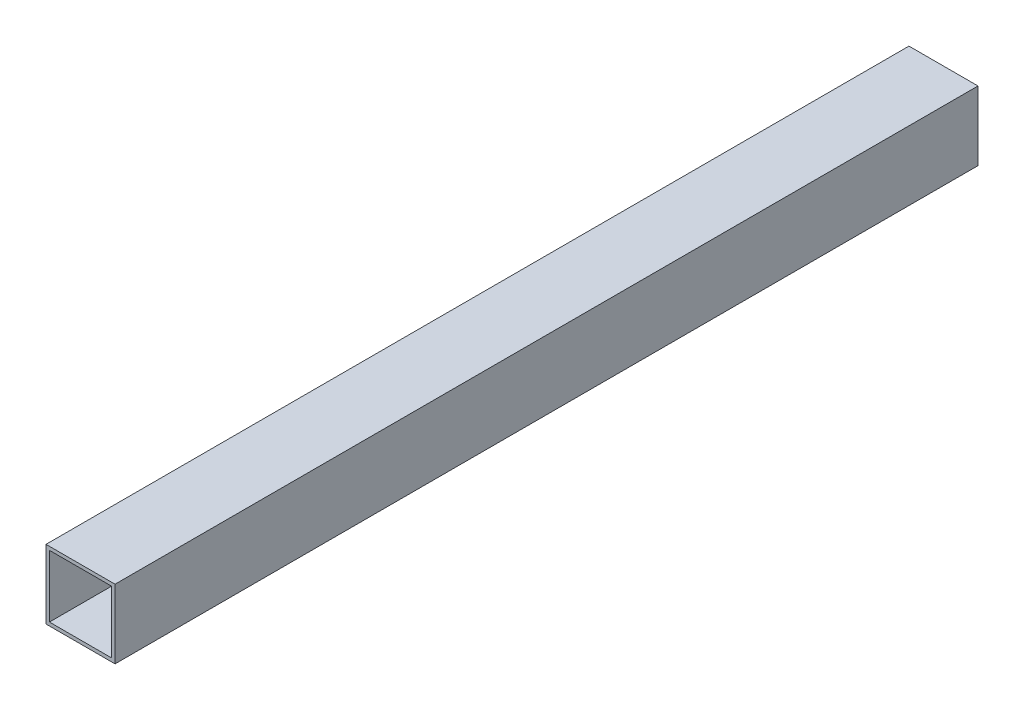
from build123d import *

# Parameters (mm, degrees)
SKETCH_1_W      = 40
SKETCH_1_H      = 40
SKETCH_1_W_2    = 36
SKETCH_1_H_2    = 36
EXTRUDE_1_DEPTH = 500


with BuildPart() as part:
    # Эскиз1 → Бобышка-Вытянуть1 (new body)
    with BuildSketch(Plane.XY):
        Rectangle(SKETCH_1_W, SKETCH_1_H)
        Rectangle(SKETCH_1_W_2, SKETCH_1_H_2, mode=Mode.SUBTRACT)
    extrude(amount=EXTRUDE_1_DEPTH)


solid = part.part
